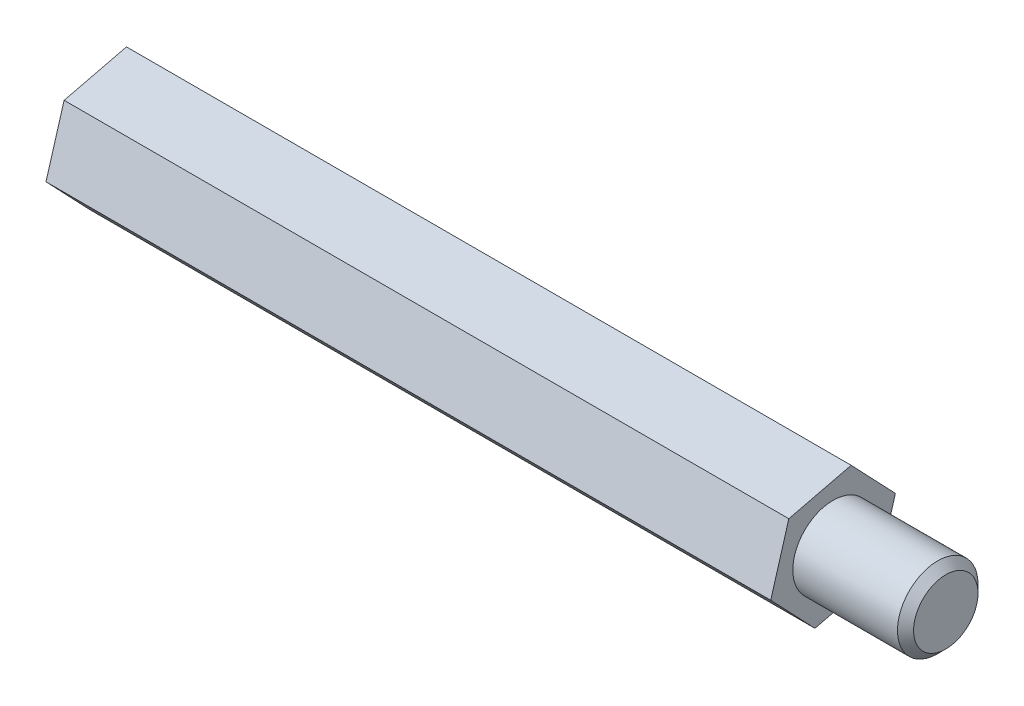
from build123d import *

# Parameters (mm, degrees)
EXTRUDE_1_DEPTH     = 45
SKETCH_2_R          = 2.5
EXTRUDE_2_DEPTH     = 7
CHAMFER_1_SIZE      = 0.5
SKETCH_3_R          = 2.5
CUT_EXTRUDE_1_DEPTH = 7


with BuildPart() as part:
    # 草图1 → 凸台-拉伸1 (new body)
    with BuildSketch(Plane(origin=(0, 0, 0), x_dir=(0, 0, -1), z_dir=(1, 0, 0))):
        Polygon((2.747304238, -2.88484305), (3.871999486, 0.936813737), (1.124695248, 3.821656787), (-2.747304238, 2.88484305), (-3.871999486, -0.936813737), (-1.124695248, -3.821656787), align=None)
    extrude(amount=EXTRUDE_1_DEPTH)

    # 草图2 → 凸台-拉伸2 (add)
    with BuildSketch(Plane(origin=(45, 0, 0), x_dir=(0, 0, -1), z_dir=(1, 0, 0))):
        Circle(SKETCH_2_R)
    extrude(amount=EXTRUDE_2_DEPTH)

    # 倒角1
    chamfer_1_edges = [part.edges().sort_by_distance(p)[0] for p in [
        (52, 0, 2.5),
    ]]
    chamfer(chamfer_1_edges, length=CHAMFER_1_SIZE)

    # 草图3 → 切除-拉伸1 (cut)
    with BuildSketch(Plane.ZY):
        with Locations(Location((0, 0, 0), (0, 0, 180))):
            Circle(SKETCH_3_R)
    extrude(amount=-CUT_EXTRUDE_1_DEPTH, mode=Mode.SUBTRACT)


solid = part.part
